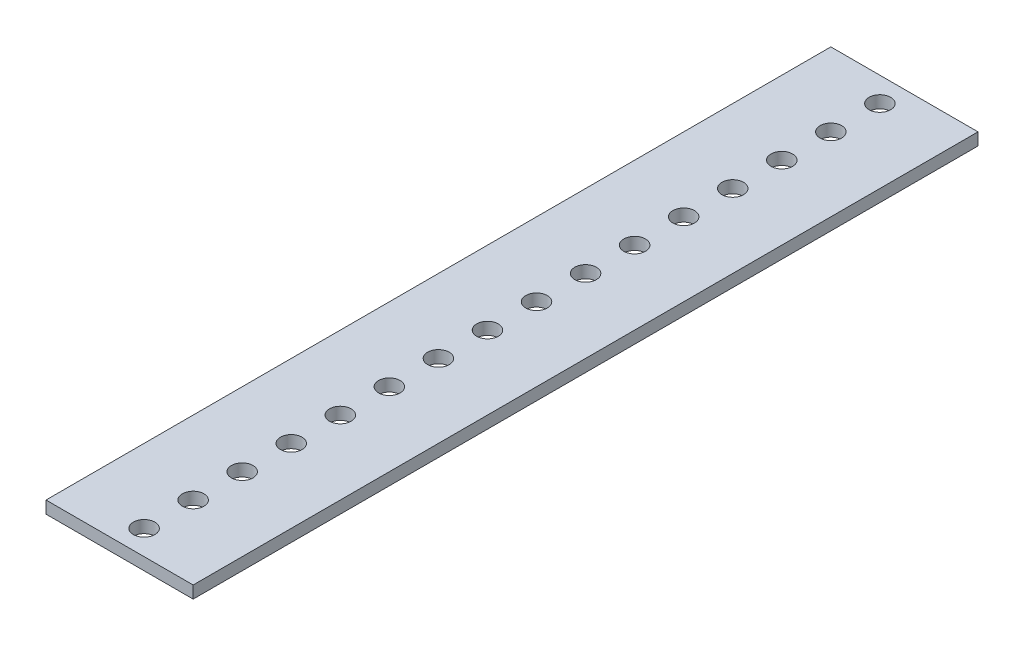
from build123d import *

# Parameters (mm, degrees)
SKETCH2_W           = 38.1
SKETCH2_H           = 203.2
BOSS_EXTRUDE1_DEPTH = 3.175
SKETCH3_R           = 2.794
CUT_EXTRUDE1_DEPTH  = 3.175
LPATTERN1_COUNT     = 16
LPATTERN1_PITCH     = 12.7


with BuildPart() as part:
    # Sketch2 → Boss-Extrude1 (new body)
    with BuildSketch(Plane(origin=(0, 0, 0), x_dir=(1, 0, 0), z_dir=(0, 1, 0))):
        Rectangle(SKETCH2_W, SKETCH2_H)
    extrude(amount=BOSS_EXTRUDE1_DEPTH)

    # Sketch3 → Cut-Extrude1 (cut)
    with BuildSketch(Plane(origin=(0, 3.175, 0), x_dir=(1, 0, 0), z_dir=(0, 1, 0))):
        with Locations(Location((0, -95.25, 0), (0, 0, 270))):
            Circle(SKETCH3_R)
    cut_extrude1 = extrude(amount=-CUT_EXTRUDE1_DEPTH, mode=Mode.SUBTRACT)

    # LPattern1: Cut-Extrude1 ×16
    with Locations(*[(0, 0, -i * LPATTERN1_PITCH) for i in range(1, LPATTERN1_COUNT)]):
        add(cut_extrude1, mode=Mode.SUBTRACT)


solid = part.part
